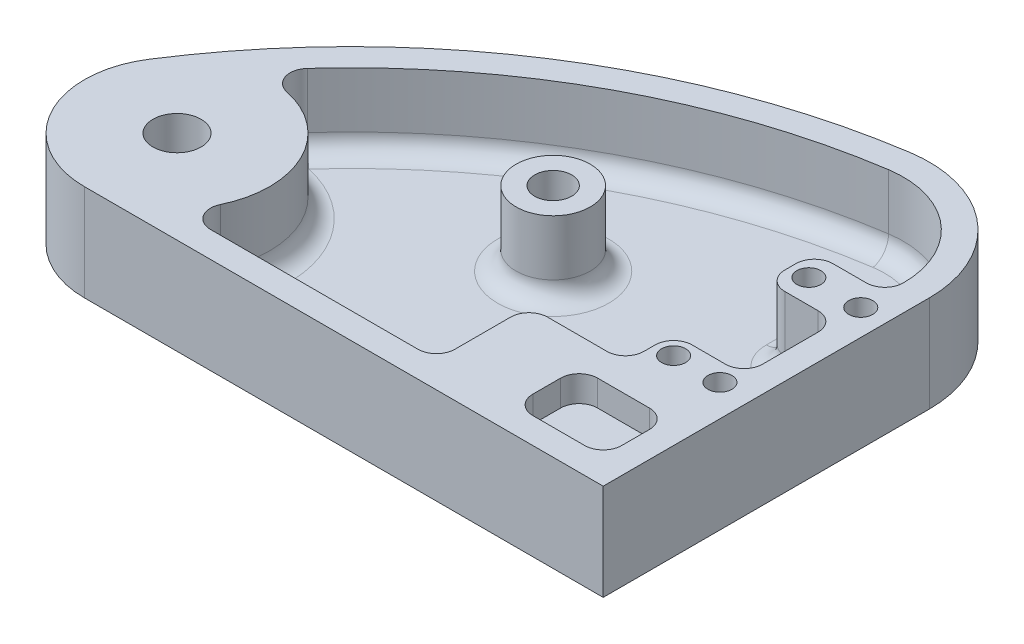
from build123d import *

# Parameters (mm, degrees)
SKETCH1_R             = 6.5
SKETCH1_R_2           = 3.25
BOSS_EXTRUDE1_DEPTH   = 26
SKETCH1_R_3           = 10
SKETCH1_R_4           = 5
BOSS_EXTRUDE1_2_DEPTH = 26
BOSS_EXTRUDE2_DEPTH   = 19
SKETCH1_4_R           = 10
BOSS_EXTRUDE3_DEPTH   = 6
FILLET1_R             = 5


with BuildPart() as part:
    # Sketch1 → Boss-Extrude1 (new body)
    with BuildSketch(Plane(origin=(0, 0, 0), x_dir=(1, 0, 0), z_dir=(0, 1, 0))):
        with BuildLine():
            ThreePointArc((-84.055690971, -25.021948297), (-84.931156976, -50.501014695), (-63, -63.5))
            Line((-63, -63.5), (77, -63.5))
            Line((77, -63.5), (77, 24.5))
            ThreePointArc((77, 24.5), (65.94372137, 48.579709215), (40.47512467, 55.888900356))
            ThreePointArc((40.47512467, 55.888900356), (-30.523492454, 28.874858685), (-84.055690971, -25.021948297))
        make_face()
        with Locations((-63, -38.5)):
            Circle(SKETCH1_R, mode=Mode.SUBTRACT)
        with BuildLine():
            Line((65, -56.5), (51, -56.5))
            ThreePointArc((51, -56.5), (47.464466094, -55.035533906), (46, -51.5))
            Line((46, -51.5), (46, -44))
            ThreePointArc((46, -44), (47.464466094, -40.464466094), (51, -39))
            Line((51, -39), (65, -39))
            ThreePointArc((65, -39), (68.535533906, -40.464466094), (70, -44))
            Line((70, -44), (70, -51.5))
            ThreePointArc((70, -51.5), (68.535533906, -55.035533906), (65, -56.5))
        make_face(mode=Mode.SUBTRACT)
        with Locations((56, -23.5)):
            Circle(SKETCH1_R_2, mode=Mode.SUBTRACT)
        with Locations((68.5, -23.5)):
            Circle(SKETCH1_R_2, mode=Mode.SUBTRACT)
        with BuildLine():
            Line((20, -56.5), (-35.962988331, -56.5))
            ThreePointArc((-35.962988331, -56.5), (-40.195796697, -54.161453237), (-40.469156942, -49.333333333))
            ThreePointArc((-40.469156942, -49.333333333), (-40.575652719, -27.447912005), (-57.867558599, -14.032510442))
            ThreePointArc((-57.867558599, -14.032510442), (-61.597455339, -10.680700417), (-60.54304515, -5.778152172))
            ThreePointArc((-60.54304515, -5.778152172), (-14.225405457, 30.391169029), (41.527853089, 48.968512876))
            ThreePointArc((41.527853089, 48.968512876), (61.381326107, 43.270796947), (70, 24.5))
            ThreePointArc((70, 24.5), (68.535533906, 20.964466094), (65, 19.5))
            Line((65, 19.5), (56, 19.5))
            ThreePointArc((56, 19.5), (52.464466094, 18.035533906), (51, 14.5))
            Line((51, 14.5), (51, 11.5))
            ThreePointArc((51, 11.5), (52.464466094, 7.964466094), (56, 6.5))
            Line((56, 6.5), (65, 6.5))
            ThreePointArc((65, 6.5), (68.535533906, 5.035533906), (70, 1.5))
            Line((70, 1.5), (70, -13.5))
            ThreePointArc((70, -13.5), (68.535533906, -17.035533906), (65, -18.5))
            Line((65, -18.5), (56, -18.5))
            ThreePointArc((56, -18.5), (52.464466094, -19.964466094), (51, -23.5))
            Line((51, -23.5), (51, -26.5))
            ThreePointArc((51, -26.5), (49.535533906, -30.035533906), (46, -31.5))
            Line((46, -31.5), (30, -31.5))
            ThreePointArc((30, -31.5), (26.464466094, -32.964466094), (25, -36.5))
            Line((25, -36.5), (25, -51.5))
            ThreePointArc((25, -51.5), (23.535533906, -55.035533906), (20, -56.5))
        make_face(mode=Mode.SUBTRACT)
        with Locations((56, 13)):
            Circle(SKETCH1_R_2, mode=Mode.SUBTRACT)
        with Locations((70, 13)):
            Circle(SKETCH1_R_2, mode=Mode.SUBTRACT)
    extrude(amount=BOSS_EXTRUDE1_DEPTH)

    # Sketch1<3> → Boss-Extrude2 (add)
    with BuildSketch(Plane(origin=(0, 0, 0), x_dir=(1, 0, 0), z_dir=(0, 1, 0))):
        with BuildLine():
            ThreePointArc((46, -51.5), (47.464466094, -55.035533906), (51, -56.5))
            Line((51, -56.5), (65, -56.5))
            ThreePointArc((65, -56.5), (68.535533906, -55.035533906), (70, -51.5))
            Line((70, -51.5), (70, -44))
            ThreePointArc((70, -44), (68.535533906, -40.464466094), (65, -39))
            Line((65, -39), (51, -39))
            ThreePointArc((51, -39), (47.464466094, -40.464466094), (46, -44))
            Line((46, -44), (46, -51.5))
        make_face()
    extrude(amount=BOSS_EXTRUDE2_DEPTH)



with BuildPart() as body_2:
    # Sketch1 → Boss-Extrude1 2 (new body)
    with BuildSketch(Plane(origin=(0, 0, 0), x_dir=(1, 0, 0), z_dir=(0, 1, 0))):
        Circle(SKETCH1_R_3)
        Circle(SKETCH1_R_4, mode=Mode.SUBTRACT)
    extrude(amount=BOSS_EXTRUDE1_2_DEPTH)


with BuildPart() as part_1:
    add(part.part)

    add(body_2.part)  # Boss-Extrude3 merges body 2
    # Sketch1<4> → Boss-Extrude3 (add)
    with BuildSketch(Plane(origin=(0, 0, 0), x_dir=(1, 0, 0), z_dir=(0, 1, 0))):
        with BuildLine():
            ThreePointArc((-40.469156942, -49.333333333), (-40.195796697, -54.161453237), (-35.962988331, -56.5))
            Line((-35.962988331, -56.5), (20, -56.5))
            ThreePointArc((20, -56.5), (23.535533906, -55.035533906), (25, -51.5))
            Line((25, -51.5), (25, -36.5))
            ThreePointArc((25, -36.5), (26.464466094, -32.964466094), (30, -31.5))
            Line((30, -31.5), (46, -31.5))
            ThreePointArc((46, -31.5), (49.535533906, -30.035533906), (51, -26.5))
            Line((51, -26.5), (51, -23.5))
            ThreePointArc((51, -23.5), (52.464466094, -19.964466094), (56, -18.5))
            Line((56, -18.5), (65, -18.5))
            ThreePointArc((65, -18.5), (68.535533906, -17.035533906), (70, -13.5))
            Line((70, -13.5), (70, 1.5))
            ThreePointArc((70, 1.5), (68.535533906, 5.035533906), (65, 6.5))
            Line((65, 6.5), (56, 6.5))
            ThreePointArc((56, 6.5), (52.464466094, 7.964466094), (51, 11.5))
            Line((51, 11.5), (51, 14.5))
            ThreePointArc((51, 14.5), (52.464466094, 18.035533906), (56, 19.5))
            Line((56, 19.5), (65, 19.5))
            ThreePointArc((65, 19.5), (68.535533906, 20.964466094), (70, 24.5))
            ThreePointArc((70, 24.5), (61.381326107, 43.270796947), (41.527853089, 48.968512876))
            ThreePointArc((41.527853089, 48.968512876), (-14.225405457, 30.391169029), (-60.54304515, -5.778152172))
            ThreePointArc((-60.54304515, -5.778152172), (-61.597455339, -10.680700417), (-57.867558599, -14.032510442))
            ThreePointArc((-57.867558599, -14.032510442), (-40.575652719, -27.447912005), (-40.469156942, -49.333333333))
        make_face()
        Circle(SKETCH1_4_R, mode=Mode.SUBTRACT)
    extrude(amount=BOSS_EXTRUDE3_DEPTH)

    # Fillet1
    fillet1_edges = [part_1.edges().sort_by_distance(p)[0] for p in [
        (-40.195796697, 6, 54.161453237),
        (-40.575652719, 6, 27.447912005),
        (-61.597455339, 6, 10.680700417),
        (-14.225405457, 6, -30.391169029),
        (61.381326107, 6, -43.270796947),
        (68.535533906, 6, -20.964466094),
        (60.5, 6, -19.5),
        (52.464466094, 6, -18.035533906),
        (51, 6, -13),
        (52.464466094, 6, -7.964466094),
        (60.5, 6, -6.5),
        (68.535533906, 6, -5.035533906),
        (70, 6, 6),
        (68.535533906, 6, 17.035533906),
        (60.5, 6, 18.5),
        (52.464466094, 6, 19.964466094),
        (51, 6, 25),
        (49.535533906, 6, 30.035533906),
        (38, 6, 31.5),
        (26.464466094, 6, 32.964466094),
        (25, 6, 44),
        (23.535533906, 6, 55.035533906),
        (-7.981494165, 6, 56.5),
        (-10, 6, 0),
    ]]
    fillet(fillet1_edges, radius=FILLET1_R)


solid = part_1.part
